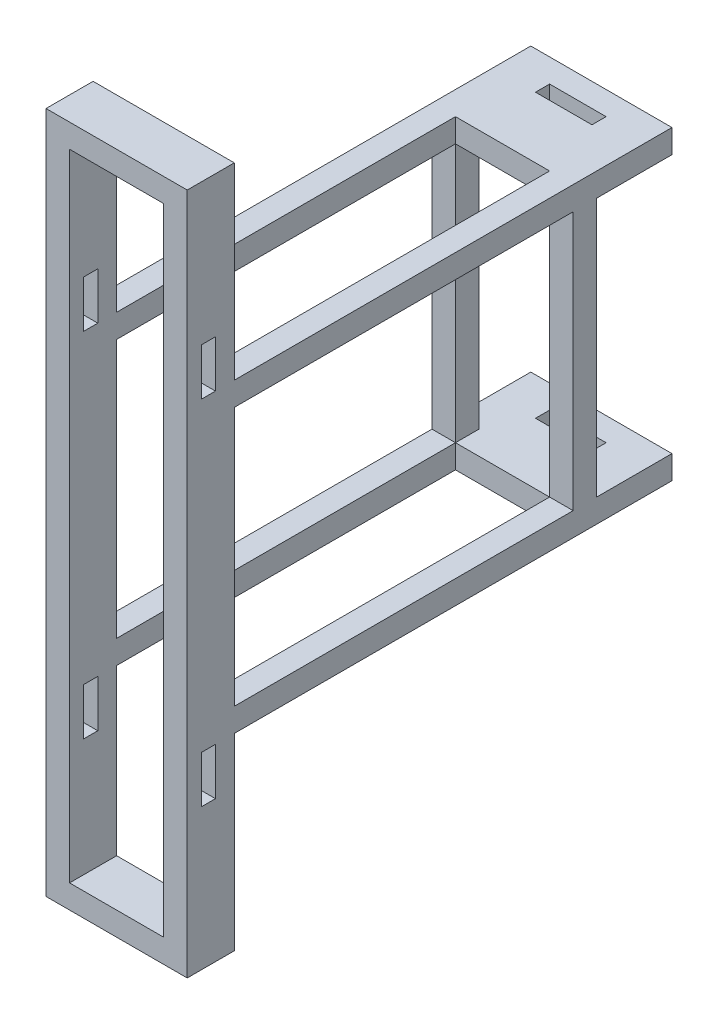
from build123d import *

# Parameters (mm, degrees)
SKETCH1_W            = 30
SKETCH1_H            = 103
BOSS_EXTRUDE1_DEPTH  = 5
SKETCH2_W            = 12
SKETCH2_H            = 3
SKETCH2_W_2          = 20
SKETCH2_H_2          = 82
CUT_EXTRUDE1_DEPTH   = 5
SKETCH3_W            = 5
SKETCH3_H            = 10
SKETCH3_H_2          = 5
BOSS_EXTRUDE2_DEPTH  = 55
SKETCH8_W            = 30
SKETCH8_H            = 103
BOSS_EXTRUDE6_DEPTH  = 5
SKETCH10_W           = 20
SKETCH10_H           = 82
SKETCH10_W_2         = 12
SKETCH10_H_2         = 3
CUT_EXTRUDE2_DEPTH   = 5
SKETCH22_W           = 5
SKETCH22_H           = 10
BOSS_EXTRUDE7_DEPTH  = 35
SKETCH23_W           = 30
SKETCH23_H           = 10
BOSS_EXTRUDE8_DEPTH  = 5
SKETCH25_W           = 5
SKETCH25_H           = 10
BOSS_EXTRUDE9_DEPTH  = 35
SKETCH26_W           = 30
SKETCH26_H           = 10
BOSS_EXTRUDE10_DEPTH = 5
SKETCH28_W           = 3
SKETCH28_H           = 10
CUT_EXTRUDE4_DEPTH   = 34


with BuildPart() as part:
    # Sketch1 → Boss-Extrude1 (new body)
    with BuildSketch(Plane(origin=(0, 0, 0), x_dir=(1, 0, 0), z_dir=(0, 1, 0))):
        with Locations((-3.526120729, 0.1485026)):
            Rectangle(SKETCH1_W, SKETCH1_H)
    extrude(amount=BOSS_EXTRUDE1_DEPTH)

    # Sketch2 → Cut-Extrude1 (cut)
    with BuildSketch(Plane(origin=(0, 5, 0), x_dir=(1, 0, 0), z_dir=(0, 1, 0))):
        with Locations((-3.526120729, 45.1485026)):
            Rectangle(SKETCH2_W, SKETCH2_H)
        with Locations((-3.526120729, -10.3514974)):
            Rectangle(SKETCH2_W_2, SKETCH2_H_2)
    extrude(amount=-CUT_EXTRUDE1_DEPTH, mode=Mode.SUBTRACT)

    # Sketch3 → Boss-Extrude2 (add)
    with BuildSketch(Plane.XZ):
        with Locations((-16.026120729, 46.3514974)):
            Rectangle(SKETCH3_W, SKETCH3_H)
        with Locations((-16.026120729, -33.1485026)):
            Rectangle(SKETCH3_W, SKETCH3_H_2)
        with Locations((8.973879271, 46.3514974)):
            Rectangle(SKETCH3_W, SKETCH3_H)
        with Locations((8.973879271, -33.1485026)):
            Rectangle(SKETCH3_W, SKETCH3_H_2)
    extrude(amount=BOSS_EXTRUDE2_DEPTH)

    # Sketch8 → Boss-Extrude6 (add)
    with BuildSketch(Plane(origin=(0, -55, 0), x_dir=(-1, 0, 0), z_dir=(0, -1, 0))):
        with Locations((3.526120729, 0.1485026)):
            Rectangle(SKETCH8_W, SKETCH8_H)
    extrude(amount=BOSS_EXTRUDE6_DEPTH)

    # Sketch10 → Cut-Extrude2 (cut)
    with BuildSketch(Plane.XZ.offset(60)):
        with Locations((-3.526120729, 10.3514974)):
            Rectangle(SKETCH10_W, SKETCH10_H)
        with Locations((-3.526120729, -45.1485026)):
            Rectangle(SKETCH10_W_2, SKETCH10_H_2)
    extrude(amount=-CUT_EXTRUDE2_DEPTH, mode=Mode.SUBTRACT)

    # Sketch22 → Boss-Extrude7 (add)
    with BuildSketch(Plane(origin=(0, 5, 0), x_dir=(1, 0, 0), z_dir=(0, 1, 0))):
        with Locations((-16.026120729, -46.3514974)):
            Rectangle(SKETCH22_W, SKETCH22_H)
        with Locations((8.973879271, -46.3514974)):
            Rectangle(SKETCH22_W, SKETCH22_H)
    extrude(amount=BOSS_EXTRUDE7_DEPTH)

    # Sketch23 → Boss-Extrude8 (add)
    with BuildSketch(Plane(origin=(0, 40, 0), x_dir=(1, 0, 0), z_dir=(0, 1, 0))):
        with Locations((-3.526120729, -46.3514974)):
            Rectangle(SKETCH23_W, SKETCH23_H)
    extrude(amount=BOSS_EXTRUDE8_DEPTH)

    # Sketch25 → Boss-Extrude9 (add)
    with BuildSketch(Plane(origin=(0, -60, 0), x_dir=(-1, 0, 0), z_dir=(0, -1, 0))):
        with Locations((16.026120729, -46.3514974)):
            Rectangle(SKETCH25_W, SKETCH25_H)
        with Locations((-8.973879271, -46.3514974)):
            Rectangle(SKETCH25_W, SKETCH25_H)
    extrude(amount=BOSS_EXTRUDE9_DEPTH)

    # Sketch26 → Boss-Extrude10 (add)
    with BuildSketch(Plane.XZ.offset(95)):
        with Locations((-3.526120729, 46.3514974)):
            Rectangle(SKETCH26_W, SKETCH26_H)
    extrude(amount=BOSS_EXTRUDE10_DEPTH)

    # Sketch28 → Cut-Extrude4 (cut)
    with BuildSketch(Plane(origin=(11.473879271, 0, 0), x_dir=(0, 0, -1), z_dir=(1, 0, 0))):
        with Locations((-46.8514974, 10)):
            Rectangle(SKETCH28_W, SKETCH28_H)
        with Locations((-46.8514974, -65)):
            Rectangle(SKETCH28_W, SKETCH28_H)
    extrude(amount=-CUT_EXTRUDE4_DEPTH, mode=Mode.SUBTRACT)


solid = part.part
